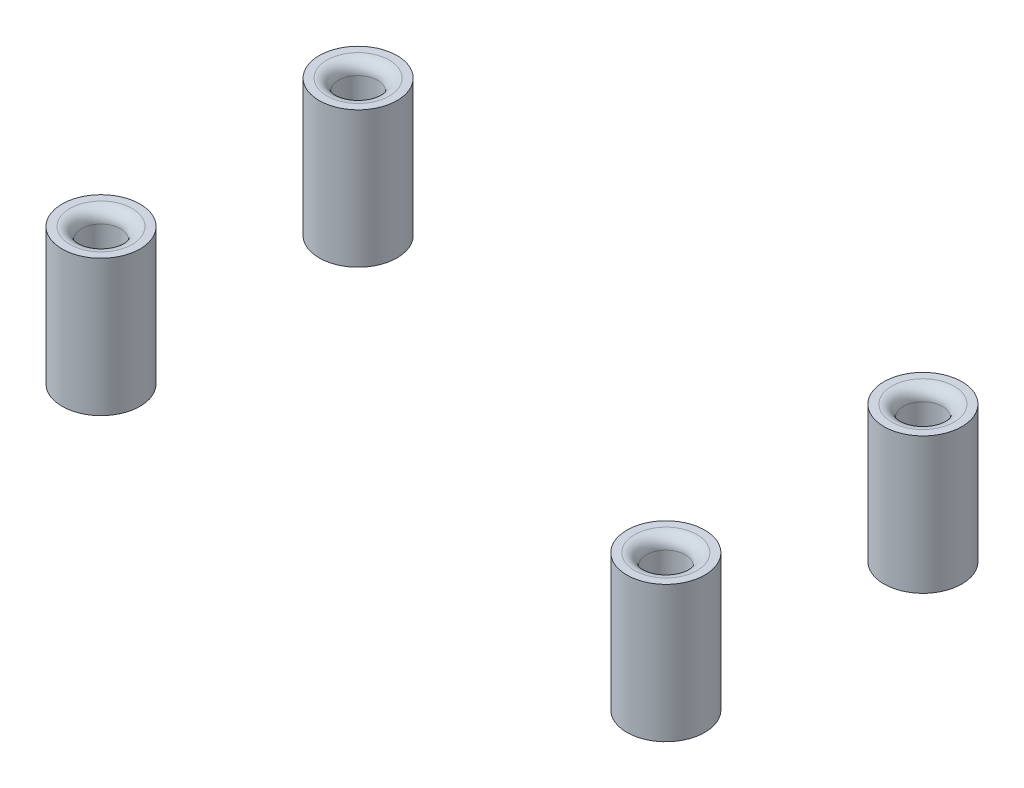
from build123d import *

# Parameters (mm, degrees)
SKETCH1_R             = 10
SKETCH1_R_2           = 5
BOSS_EXTRUDE1_DEPTH   = 35
BOSS_EXTRUDE1_2_DEPTH = 35
BOSS_EXTRUDE1_3_DEPTH = 35
BOSS_EXTRUDE1_4_DEPTH = 35
FILLET2_R             = 3
FILLET3_R             = 3
FILLET4_R             = 3
FILLET5_R             = 3


with BuildPart() as part:
    # Sketch1 → Boss-Extrude1 (new body)
    with BuildSketch(Plane(origin=(0, 0, 0), x_dir=(1, 0, 0), z_dir=(0, 1, 0))):
        with Locations(Location((-72.5, -33, 0), (0, 0, 270))):
            Circle(SKETCH1_R)
        with Locations(Location((-72.5, -33, 0), (0, 0, 270))):
            Circle(SKETCH1_R_2, mode=Mode.SUBTRACT)
    extrude(amount=BOSS_EXTRUDE1_DEPTH)

    # Fillet4
    fillet4_edges = [part.edges().sort_by_distance(p)[0] for p in [
        (-72.5, 35, 28),
    ]]
    fillet(fillet4_edges, radius=FILLET4_R)


with BuildPart() as body_2:
    # Sketch1 → Boss-Extrude1 2 (new body)
    with BuildSketch(Plane(origin=(0, 0, 0), x_dir=(1, 0, 0), z_dir=(0, 1, 0))):
        with Locations(Location((-72.5, 33, 0), (0, 0, 270))):
            Circle(SKETCH1_R)
        with Locations(Location((-72.5, 33, 0), (0, 0, 270))):
            Circle(SKETCH1_R_2, mode=Mode.SUBTRACT)
    extrude(amount=BOSS_EXTRUDE1_2_DEPTH)

    # Fillet3
    fillet3_edges = [body_2.edges().sort_by_distance(p)[0] for p in [
        (-72.5, 35, -38),
    ]]
    fillet(fillet3_edges, radius=FILLET3_R)


with BuildPart() as body_3:
    # Sketch1 → Boss-Extrude1 3 (new body)
    with BuildSketch(Plane(origin=(0, 0, 0), x_dir=(1, 0, 0), z_dir=(0, 1, 0))):
        with Locations(Location((72.5, -33, 0), (0, 0, 270))):
            Circle(SKETCH1_R)
        with Locations(Location((72.5, -33, 0), (0, 0, 270))):
            Circle(SKETCH1_R_2, mode=Mode.SUBTRACT)
    extrude(amount=BOSS_EXTRUDE1_3_DEPTH)

    # Fillet5
    fillet5_edges = [body_3.edges().sort_by_distance(p)[0] for p in [
        (72.5, 35, 28),
    ]]
    fillet(fillet5_edges, radius=FILLET5_R)


with BuildPart() as body_4:
    # Sketch1 → Boss-Extrude1 4 (new body)
    with BuildSketch(Plane(origin=(0, 0, 0), x_dir=(1, 0, 0), z_dir=(0, 1, 0))):
        with Locations(Location((72.5, 33, 0), (0, 0, 270))):
            Circle(SKETCH1_R)
        with Locations(Location((72.5, 33, 0), (0, 0, 270))):
            Circle(SKETCH1_R_2, mode=Mode.SUBTRACT)
    extrude(amount=BOSS_EXTRUDE1_4_DEPTH)

    # Fillet2
    fillet2_edges = [body_4.edges().sort_by_distance(p)[0] for p in [
        (72.5, 35, -38),
    ]]
    fillet(fillet2_edges, radius=FILLET2_R)


solid = Compound([part.part, body_2.part, body_3.part, body_4.part])
